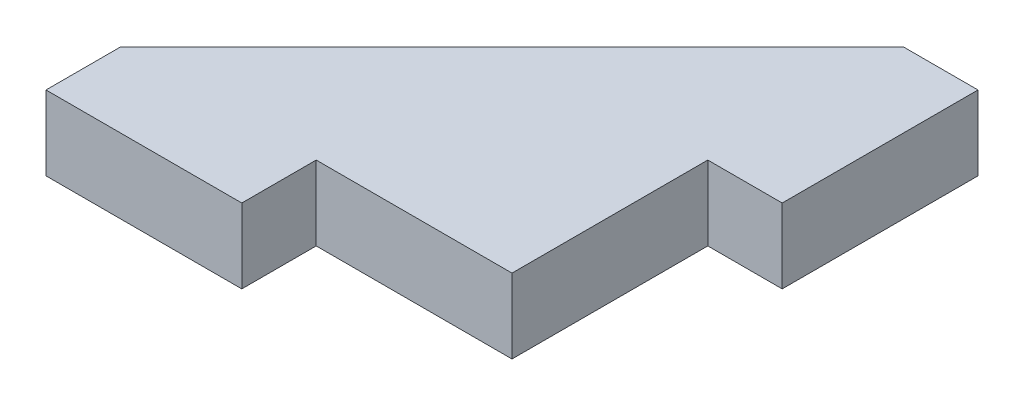
from build123d import *

# Parameters (mm, degrees)
SKETCH1_W           = 12.7
SKETCH1_H           = 4.826
SKETCH1_W_2         = 4.826
SKETCH1_H_2         = 12.7
BOSS_EXTRUDE1_DEPTH = 4.826


with BuildPart() as part:
    # Sketch1 → Boss-Extrude1 (new body)
    with BuildSketch(Plane(origin=(0, 0, 0), x_dir=(1, 0, 0), z_dir=(0, 1, 0))):
        with Locations((-14.711985437, -16.035114223)):
            Rectangle(SKETCH1_W, SKETCH1_H)
        Polygon((4.338014563, 11.777885777), (4.338014563, -13.622114223), (-21.061985437, -13.622114223), align=None)
        with Locations((6.751014563, 5.427885777)):
            Rectangle(SKETCH1_W_2, SKETCH1_H_2)
    extrude(amount=BOSS_EXTRUDE1_DEPTH)


solid = part.part
